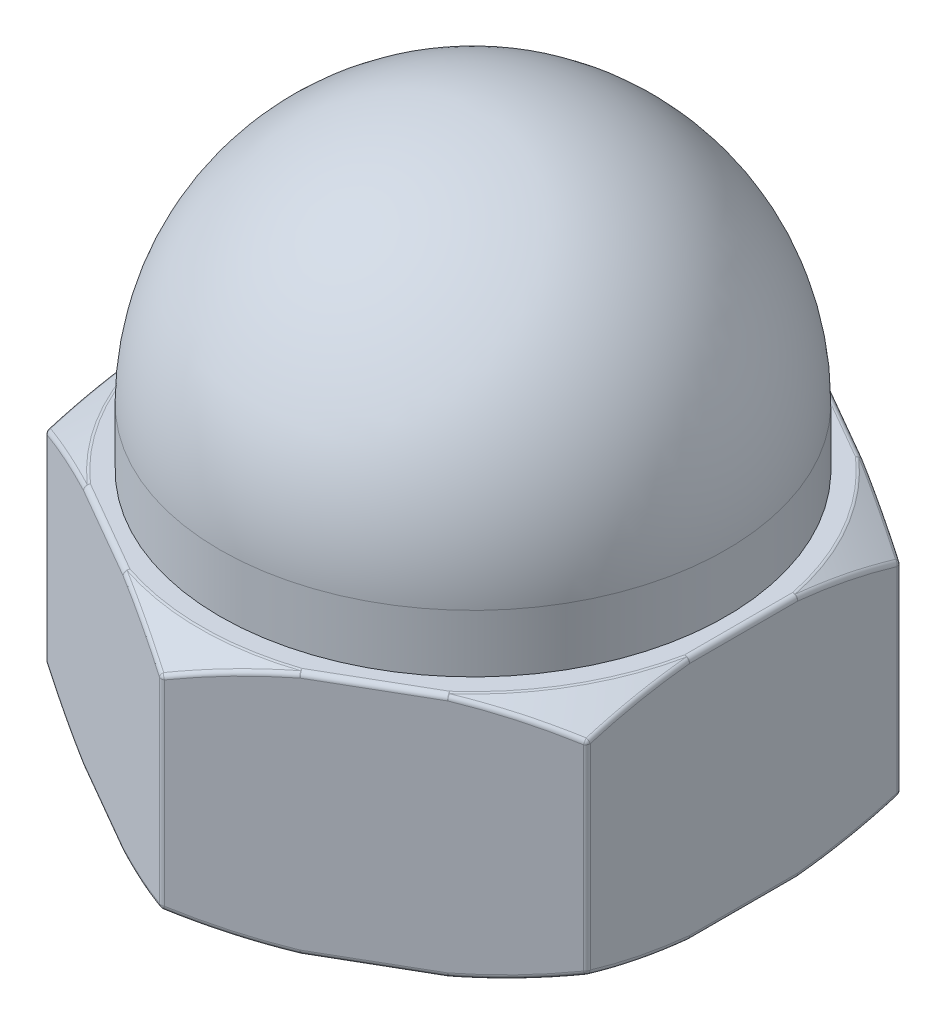
from build123d import *

# Parameters (mm, degrees)
SALIENTE_EXTRUIR1_DEPTH = 2.45
CROQUIS2_R              = 2.525
SALIENTE_EXTRUIR2_DEPTH = 3.1
REDONDEO1_R             = 2.525
REDONDEO2_R             = 0.05
CROQUIS4_R              = 1.15
CORTAR_EXTRUIR1_DEPTH   = 4.85
CHAFL_N1_SIZE           = 0.2


with BuildPart() as part:
    # Croquis1 → Saliente-Extruir1 (new body)
    with BuildSketch(Plane(origin=(0, 0, 0), x_dir=(1, 0, 0), z_dir=(0, 1, 0))):
        Polygon((-2.7, -1.558845727), (-2.7, 1.558845727), (0, 3.117691454), (2.7, 1.558845727), (2.7, -1.558845727), (0, -3.117691454), align=None)
    extrude(amount=SALIENTE_EXTRUIR1_DEPTH)

    # Croquis3 → Cortar-Revolución4 (revolve, cut)
    with BuildSketch(Plane(origin=(0, 0, 0), x_dir=(0.8660254037844386, 0, -0.5000000000000003), z_dir=(0.5000000000000003, 0, 0.8660254037844386))):
        with BuildLine():
            Line((3.117691454, 4.226402247), (3.117691454, 2.226402247))
            ThreePointArc((3.117691454, 2.226402247), (1.618886425, 2.87747408), (0, 3.1))
            Line((0, 3.1), (0, 4.226402247))
            Line((0, 4.226402247), (3.117691454, 4.226402247))
        make_face()
    cortar_revoluci_n4 = revolve(axis=Axis((0, 0, 0), (0, 1, 0)), mode=Mode.SUBTRACT)

    # Simetría1: Cortar-Revolución4 across plane
    add(cortar_revoluci_n4.mirror(Plane.ZX.offset(1.225)), mode=Mode.SUBTRACT)

    # Croquis2 → Saliente-Extruir2 (add)
    with BuildSketch(Plane(origin=(0, 2.45, 0), x_dir=(1, 0, 0), z_dir=(0, 1, 0))):
        with Locations(Location((0, 0, 0), (0, 0, 90))):
            Circle(CROQUIS2_R)
    extrude(amount=SALIENTE_EXTRUIR2_DEPTH)

    # Redondeo1
    redondeo1_edges = [part.edges().sort_by_distance(p)[0] for p in [
        (0, 5.55, 2.525),
    ]]
    fillet(redondeo1_edges, radius=REDONDEO1_R)

    # Redondeo2
    redondeo2_edges = [part.edges().sort_by_distance(p)[0] for p in [
        (-2.7, 0, 0),
        (-2.7, 0.07386793, -0.934039818),
        (-2.7, 2.37613207, -0.934039818),
        (-2.7, 2.45, 0),
        (-2.7, 2.37613207, 0.934039818),
        (-2.7, 0.07386793, 0.934039818),
        (-1.35, 0, -2.33826859),
        (-0.54109779, 0.07386793, -2.805288499),
        (-0.54109779, 2.37613207, -2.805288499),
        (-1.35, 2.45, -2.33826859),
        (-2.15890221, 2.37613207, -1.871248681),
        (-2.7, 1.225, -1.558845727),
        (-2.15890221, 0.07386793, -1.871248681),
        (1.35, 0, -2.33826859),
        (2.15890221, 0.07386793, -1.871248681),
        (2.15890221, 2.37613207, -1.871248681),
        (1.35, 2.45, -2.33826859),
        (0.54109779, 2.37613207, -2.805288499),
        (0, 1.225, -3.117691454),
        (0.54109779, 0.07386793, -2.805288499),
        (2.7, 0, 0),
        (2.7, 0.07386793, 0.934039818),
        (2.7, 2.37613207, 0.934039818),
        (2.7, 2.45, 0),
        (2.7, 2.37613207, -0.934039818),
        (2.7, 1.225, -1.558845727),
        (2.7, 0.07386793, -0.934039818),
        (-1.35, 0, 2.33826859),
        (-2.15890221, 0.07386793, 1.871248681),
        (-2.7, 1.225, 1.558845727),
        (-2.15890221, 2.37613207, 1.871248681),
        (-1.35, 2.45, 2.33826859),
        (-0.54109779, 2.37613207, 2.805288499),
        (-0.54109779, 0.07386793, 2.805288499),
        (1.35, 0, 2.33826859),
        (0.54109779, 0.07386793, 2.805288499),
        (0, 1.225, 3.117691454),
        (0.54109779, 2.37613207, 2.805288499),
        (1.35, 2.45, 2.33826859),
        (2.15890221, 2.37613207, 1.871248681),
        (2.7, 1.225, 1.558845727),
        (2.15890221, 0.07386793, 1.871248681),
        (-2.352259552, 0, 1.358077686),
        (0, 0, 2.716155371),
        (2.352259552, 0, 1.358077686),
        (2.352259552, 0, -1.358077686),
        (0, 0, -2.716155371),
        (-2.352259552, 0, -1.358077686),
        (-2.352259552, 2.45, 1.358077686),
        (0, 2.45, 2.716155371),
        (2.352259552, 2.45, 1.358077686),
        (2.352259552, 2.45, -1.358077686),
        (0, 2.45, -2.716155371),
    ]]
    fillet(redondeo2_edges, radius=REDONDEO2_R)

    # Croquis4 → Cortar-Extruir1 (cut)
    with BuildSketch(Plane.XZ):
        with Locations(Location((0, 0, 0), (0, 0, 270))):
            Circle(CROQUIS4_R)
    extrude(amount=-CORTAR_EXTRUIR1_DEPTH, mode=Mode.SUBTRACT)

    # Chaflán1
    chafl_n1_edges = [part.edges().sort_by_distance(p)[0] for p in [
        (0, 0, 1.15),
    ]]
    chamfer(chafl_n1_edges, length=CHAFL_N1_SIZE)


solid = part.part
